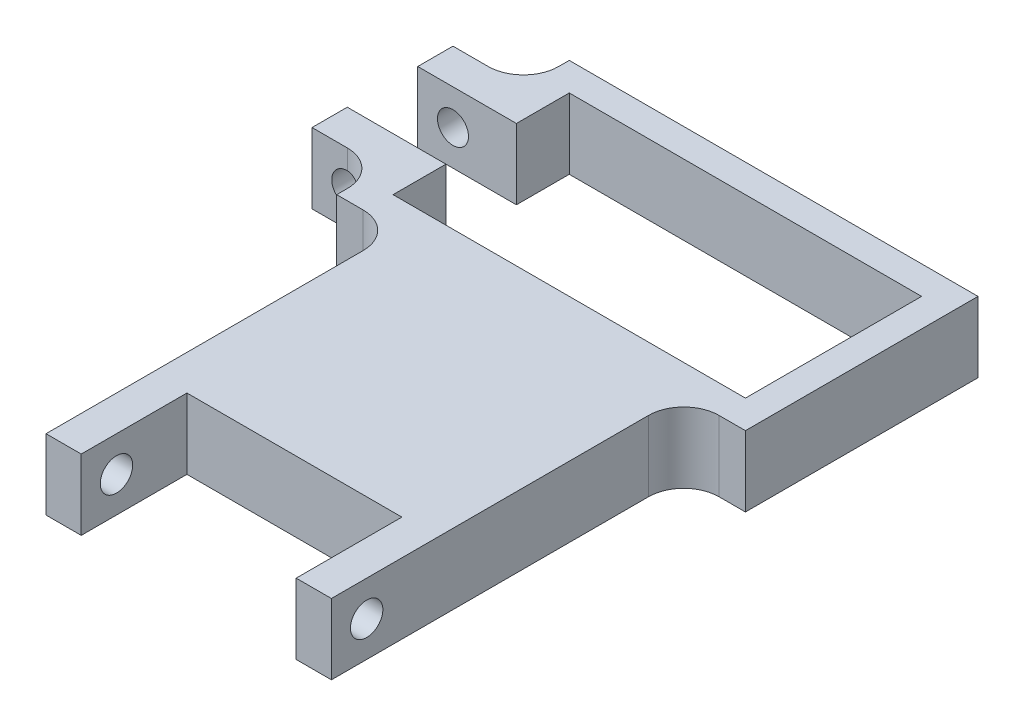
from build123d import *

# Parameters (mm, degrees)
CROQUIS1_W                 = 58
CROQUIS1_H                 = 33
CROQUIS1_W_2               = 50
CROQUIS1_H_2               = 25
SALIENTE_EXTRUIR1_DEPTH    = 10
REDONDEO1_R                = 5
REDONDEO2_R                = 5
CROQUIS2_R                 = 2.3
CORTAR_EXTRUIR1_DEPTH      = 52
CROQUIS3_W                 = 4
CROQUIS3_H                 = 10
CORTAR_EXTRUIR2_DEPTH      = 20
CROQUIS4_W                 = 5
CROQUIS4_H                 = 10
SALIENTE_EXTRUIR2_DEPTH    = 10
REDONDEO3_R                = 5
REDONDEO4_R                = 5
CORTAR_EXTRUIR4_DEPTH      = 27
CORTAR_EXTRUIR4_DEPTH_BACK = 27
CROQUIS5_R                 = 2.2


with BuildPart() as part:
    # Croquis1 → Saliente-Extruir1 (new body)
    # profile 1 of 2: a face of its own
    with BuildSketch(Plane(origin=(0, 0, 0), x_dir=(1, 0, 0), z_dir=(0, 1, 0))):
        Rectangle(CROQUIS1_W, CROQUIS1_H)
        Rectangle(CROQUIS1_W_2, CROQUIS1_H_2, mode=Mode.SUBTRACT)
    # profile 2 of 2: a face of its own
    with BuildSketch(Plane(origin=(0, 0, 0), x_dir=(1, 0, 0), z_dir=(0, 1, 0))):
        Polygon((20.25, -16.5), (-20.25, -16.5), (-20.25, -66.5), (-15.25, -66.5), (-15.25, -51.5), (15.25, -51.5), (15.25, -66.5), (20.25, -66.5), align=None)
    extrude(amount=SALIENTE_EXTRUIR1_DEPTH)

    # Redondeo1
    redondeo1_edges = [part.edges().sort_by_distance(p)[0] for p in [
        (20.25, 5, 16.5),
    ]]
    fillet(redondeo1_edges, radius=REDONDEO1_R)

    # Redondeo2
    redondeo2_edges = [part.edges().sort_by_distance(p)[0] for p in [
        (-20.25, 5, 16.5),
    ]]
    fillet(redondeo2_edges, radius=REDONDEO2_R)

    # Croquis2 → Cortar-Extruir1 (cut)
    with BuildSketch(Plane.ZY.offset(20.25)):
        with Locations((61.5, 5)):
            Circle(CROQUIS2_R)
    extrude(amount=-CORTAR_EXTRUIR1_DEPTH, mode=Mode.SUBTRACT)

    # Croquis3 → Cortar-Extruir2 (cut)
    with BuildSketch(Plane.XZ):
        with Locations((-27, 0)):
            Rectangle(CROQUIS3_W, CROQUIS3_H)
    extrude(amount=-CORTAR_EXTRUIR2_DEPTH, mode=Mode.SUBTRACT)

    # Croquis4 → Saliente-Extruir2 (add)
    with BuildSketch(Plane.ZY.offset(29)):
        with Locations((-7.5, 5)):
            Rectangle(CROQUIS4_W, CROQUIS4_H)
        with Locations((7.5, 5)):
            Rectangle(CROQUIS4_W, CROQUIS4_H)
    extrude(amount=SALIENTE_EXTRUIR2_DEPTH)

    # Redondeo3
    redondeo3_edges = [part.edges().sort_by_distance(p)[0] for p in [
        (-29, 5, -10),
    ]]
    fillet(redondeo3_edges, radius=REDONDEO3_R)

    # Redondeo4
    redondeo4_edges = [part.edges().sort_by_distance(p)[0] for p in [
        (-29, 5, 10),
    ]]
    fillet(redondeo4_edges, radius=REDONDEO4_R)

    # Croquis5 → Cortar-Extruir4 (cut, two sides: drawn at the far end of the back side and taken through both)
    with BuildSketch(Plane.XY.offset(10).offset(-CORTAR_EXTRUIR4_DEPTH_BACK)):
        with Locations(Location((-34, 5, 0), (0, 0, 90))):
            Circle(CROQUIS5_R)
    extrude(amount=CORTAR_EXTRUIR4_DEPTH + CORTAR_EXTRUIR4_DEPTH_BACK, mode=Mode.SUBTRACT)


solid = part.part
